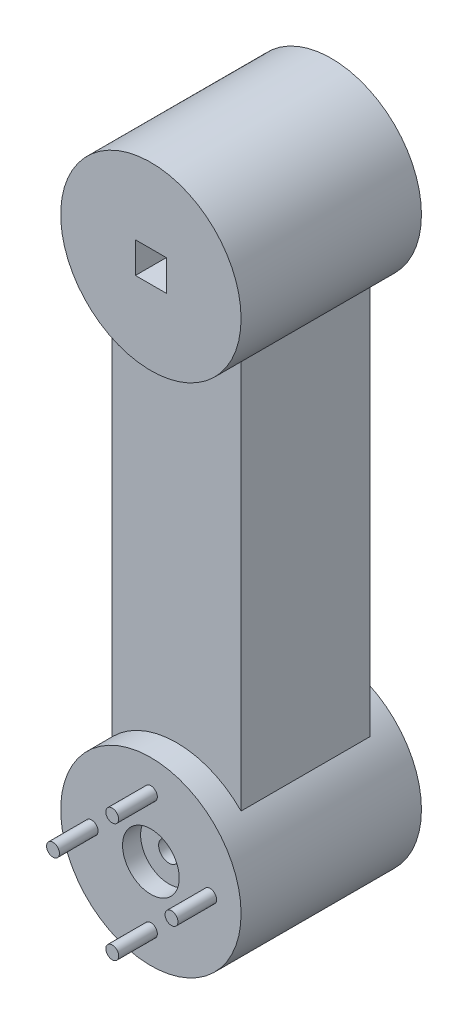
from build123d import *

# Parameters (mm, degrees)
CROQUIS1_R              = 35
SALIENTE_EXTRUIR1_DEPTH = 70
CROQUIS2_W              = 50
CROQUIS2_H              = 50
SALIENTE_EXTRUIR2_DEPTH = 200
CROQUIS4_R              = 35
SALIENTE_EXTRUIR4_DEPTH = 70
CROQUIS5_R              = 4
CORTAR_EXTRUIR1_DEPTH   = 150
CROQUIS6_R              = 11
CORTAR_EXTRUIR3_DEPTH   = 7
CORTAR_EXTRUIR4_START   = -7
CROQUIS7_R              = 11
CORTAR_EXTRUIR4_DEPTH   = 7
CROQUIS8_R              = 2.5
SALIENTE_EXTRUIR5_DEPTH = 15
CROQUIS9_W              = 12
CROQUIS9_H              = 12
CORTAR_EXTRUIR5_DEPTH   = 152


with BuildPart() as part:
    # Croquis1 → Saliente-Extruir1 (new body)
    with BuildSketch(Plane.XY):
        Circle(CROQUIS1_R)
    extrude(amount=SALIENTE_EXTRUIR1_DEPTH)

    # Croquis2 → Saliente-Extruir2 (add)
    with BuildSketch(Plane(origin=(0, 0, 0), x_dir=(1, 0, 0), z_dir=(0, 1, 0))):
        with Locations((0, -35)):
            Rectangle(CROQUIS2_W, CROQUIS2_H)
    extrude(amount=SALIENTE_EXTRUIR2_DEPTH)

    # Croquis4 → Saliente-Extruir4 (add)
    with BuildSketch(Plane.XY):
        with Locations((0, 200)):
            Circle(CROQUIS4_R)
    extrude(amount=SALIENTE_EXTRUIR4_DEPTH)

    # Croquis5 → Cortar-Extruir1 (cut)
    with BuildSketch(Plane.XY):
        Circle(CROQUIS5_R)
    extrude(amount=CORTAR_EXTRUIR1_DEPTH, mode=Mode.SUBTRACT)

    # Croquis6 → Cortar-Extruir3 (cut)
    with BuildSketch(Plane.XY):
        Circle(CROQUIS6_R)
    extrude(amount=CORTAR_EXTRUIR3_DEPTH, mode=Mode.SUBTRACT)

    # Croquis7 → Cortar-Extruir4 (cut)
    with BuildSketch(Plane.XY.offset(70).offset(CORTAR_EXTRUIR4_START)):
        Circle(CROQUIS7_R)
    extrude(amount=CORTAR_EXTRUIR4_DEPTH, mode=Mode.SUBTRACT)

    # Croquis8 → Saliente-Extruir5 (add)
    with BuildSketch(Plane.XY.offset(70)):
        with Locations((-23, 0)):
            Circle(CROQUIS8_R)
        with Locations((0, -23)):
            Circle(CROQUIS8_R)
        with Locations((23, 0)):
            Circle(CROQUIS8_R)
        with Locations((0, 23)):
            Circle(CROQUIS8_R)
    extrude(amount=SALIENTE_EXTRUIR5_DEPTH)

    # Croquis9 → Cortar-Extruir5 (cut)
    with BuildSketch(Plane.XY.offset(70)):
        with Locations((0, 200)):
            Rectangle(CROQUIS9_W, CROQUIS9_H)
    extrude(amount=-CORTAR_EXTRUIR5_DEPTH, mode=Mode.SUBTRACT)


solid = part.part
